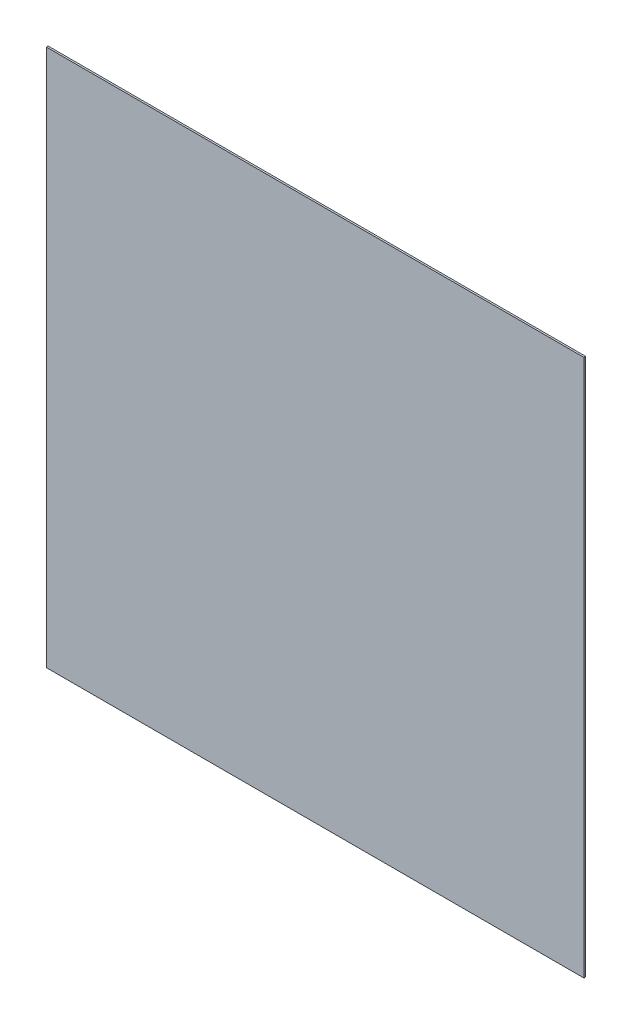
from build123d import *

# Parameters (mm, degrees)
SKETCH_1_W      = 300
SKETCH_1_H      = 300
EXTRUDE_1_DEPTH = 1


with BuildPart() as part:
    # 草图1 → 凸台-拉伸1 (new body)
    with BuildSketch(Plane.XY):
        Rectangle(SKETCH_1_W, SKETCH_1_H)
    extrude(amount=EXTRUDE_1_DEPTH)


solid = part.part
